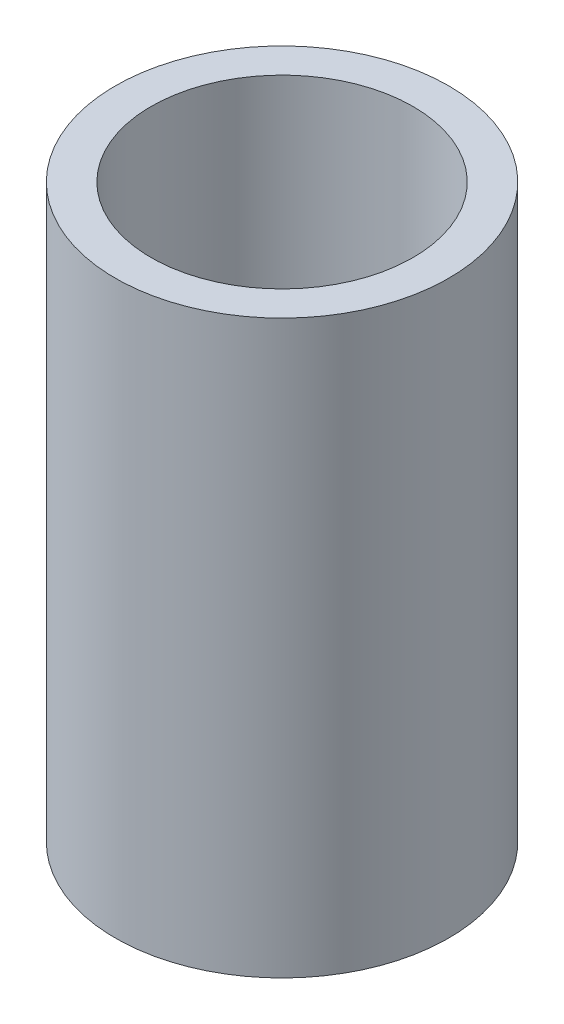
from build123d import *

# Parameters (mm, degrees)
SKETCH1_R           = 44.45
SKETCH1_R_2         = 34.925
BOSS_EXTRUDE1_DEPTH = 152.4


with BuildPart() as part:
    # Sketch1 → Boss-Extrude1 (new body)
    with BuildSketch(Plane(origin=(0, 0, 0), x_dir=(1, 0, 0), z_dir=(0, 1, 0))):
        with Locations(Location((0, 0, 0), (0, 0, 90))):
            Circle(SKETCH1_R)
        with Locations(Location((0, 0, 0), (0, 0, 90))):
            Circle(SKETCH1_R_2, mode=Mode.SUBTRACT)
    extrude(amount=BOSS_EXTRUDE1_DEPTH)


solid = part.part
